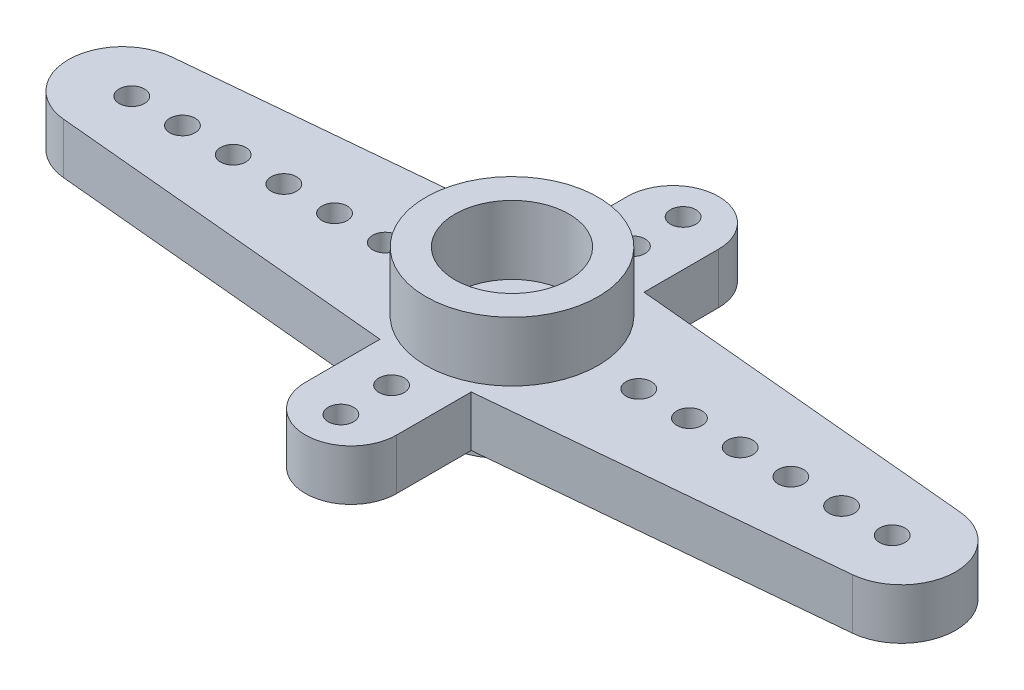
from build123d import *

# Parameters (mm, degrees)
SKETCH_1_R      = 3.4
SKETCH_1_R_2    = 2.25
EXTRUDE_1_DEPTH = 4.85
EXTRUDE_START   = 0.5
SKETCH_2_R      = 2.25
SKETCH_2_R_2    = 0.5
EXTRUDE_2_DEPTH = 2
EXTRUDE_START_2 = 1.25
SKETCH_3_R      = 2.25
SKETCH_3_R_2    = 1.15
EXTRUDE_3_DEPTH = 0.9


with BuildPart() as part:
    # 草图1 → 凸台-拉伸1 (new body)
    with BuildSketch(Plane(origin=(0, 0, 0), x_dir=(1, 0, 0), z_dir=(0, 1, 0))):
        with Locations(Location((0, 0, 0), (0, 0, 270))):
            Circle(SKETCH_1_R)
        with Locations(Location((0, 0, 0), (0, 0, 270))):
            Circle(SKETCH_1_R_2, mode=Mode.SUBTRACT)
    extrude(amount=EXTRUDE_1_DEPTH)

    # 草图2 → 凸台-拉伸2 (add)
    with BuildSketch(Plane(origin=(0, 0, 0), x_dir=(1, 0, 0), z_dir=(0, 1, 0)).offset(EXTRUDE_START)):
        with BuildLine():
            Line((1.799999992, 3.407857144), (1.799999992, 6.35))
            ThreePointArc((1.799999992, 6.35), (0, 8.149999992), (-1.799999992, 6.35))
            Line((-1.799999992, 6.35), (-1.799999992, 3.407857144))
            Line((-1.799999992, 3.407857144), (-15.558352909, 2.130295801))
            ThreePointArc((-15.558352909, 2.130295801), (-17.5, 0), (-15.558352909, -2.130295801))
            Line((-15.558352909, -2.130295801), (-1.799999992, -3.407857144))
            Line((-1.799999992, -3.407857144), (-1.799999992, -6.35))
            ThreePointArc((-1.799999992, -6.35), (0, -8.149999992), (1.799999992, -6.35))
            Line((1.799999992, -6.35), (1.799999992, -3.407857144))
            Line((1.799999992, -3.407857144), (15.558352909, -2.130295801))
            ThreePointArc((15.558352909, -2.130295801), (17.5, 0), (15.558352909, 2.130295801))
            Line((15.558352909, 2.130295801), (1.799999992, 3.407857144))
        make_face()
        with Locations(Location((0, 0, 0), (0, 0, 270))):
            Circle(SKETCH_2_R, mode=Mode.SUBTRACT)
        with Locations(Location((0, -6.75, 0), (0, 0, 270))):
            Circle(SKETCH_2_R_2, mode=Mode.SUBTRACT)
        with Locations(Location((0, -4.75, 0), (0, 0, 270))):
            Circle(SKETCH_2_R_2, mode=Mode.SUBTRACT)
        with Locations(Location((15, 0, 0), (0, 0, 270))):
            Circle(SKETCH_2_R_2, mode=Mode.SUBTRACT)
        with Locations(Location((13, 0, 0), (0, 0, 270))):
            Circle(SKETCH_2_R_2, mode=Mode.SUBTRACT)
        with Locations(Location((11, 0, 0), (0, 0, 270))):
            Circle(SKETCH_2_R_2, mode=Mode.SUBTRACT)
        with Locations(Location((9, 0, 0), (0, 0, 270))):
            Circle(SKETCH_2_R_2, mode=Mode.SUBTRACT)
        with Locations(Location((7, 0, 0), (0, 0, 270))):
            Circle(SKETCH_2_R_2, mode=Mode.SUBTRACT)
        with Locations(Location((5, 0, 0), (0, 0, 270))):
            Circle(SKETCH_2_R_2, mode=Mode.SUBTRACT)
        with Locations(Location((0, 6.75, 0), (0, 0, 270))):
            Circle(SKETCH_2_R_2, mode=Mode.SUBTRACT)
        with Locations(Location((0, 4.75, 0), (0, 0, 270))):
            Circle(SKETCH_2_R_2, mode=Mode.SUBTRACT)
        with Locations(Location((-5, 0, 0), (0, 0, 270))):
            Circle(SKETCH_2_R_2, mode=Mode.SUBTRACT)
        with Locations(Location((-7, 0, 0), (0, 0, 270))):
            Circle(SKETCH_2_R_2, mode=Mode.SUBTRACT)
        with Locations(Location((-9, 0, 0), (0, 0, 270))):
            Circle(SKETCH_2_R_2, mode=Mode.SUBTRACT)
        with Locations(Location((-11, 0, 0), (0, 0, 270))):
            Circle(SKETCH_2_R_2, mode=Mode.SUBTRACT)
        with Locations(Location((-13, 0, 0), (0, 0, 270))):
            Circle(SKETCH_2_R_2, mode=Mode.SUBTRACT)
        with Locations(Location((-15, 0, 0), (0, 0, 270))):
            Circle(SKETCH_2_R_2, mode=Mode.SUBTRACT)
    extrude(amount=EXTRUDE_2_DEPTH)

    # 草图3 → 凸台-拉伸3 (add)
    with BuildSketch(Plane(origin=(0, 0, 0), x_dir=(1, 0, 0), z_dir=(0, 1, 0)).offset(EXTRUDE_START_2)):
        with Locations(Location((0, 0, 0), (0, 0, 270))):
            Circle(SKETCH_3_R)
        with Locations(Location((0, 0, 0), (0, 0, 270))):
            Circle(SKETCH_3_R_2, mode=Mode.SUBTRACT)
    extrude(amount=EXTRUDE_3_DEPTH)


solid = part.part
